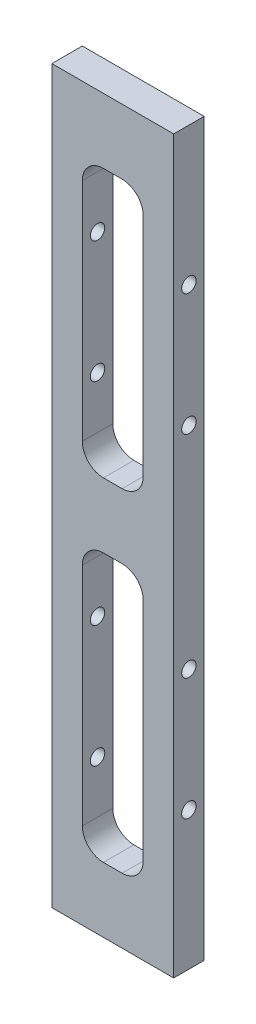
from build123d import *

# Parameters (mm, degrees)
SKETCH1_W             = 19.05
SKETCH1_H             = 114.3
BOSS_EXTRUDE1_DEPTH   = 4.7625
SKETCH2_W             = 9.525
SKETCH2_H             = 41.91
CUT_EXTRUDE1_DEPTH    = 59.13372112
FILLET1_R             = 3.302
F_4_40_TAPPED_HOLE1_D = 2.2606


with BuildPart() as part:
    # Sketch1 → Boss-Extrude1 (new body)
    with BuildSketch(Plane.XY):
        Rectangle(SKETCH1_W, SKETCH1_H)
    extrude(amount=BOSS_EXTRUDE1_DEPTH)

    # Sketch2 → Cut-Extrude1 (cut, through all)
    with BuildSketch(Plane.XY.offset(4.7625)):
        with Locations((0, 26.035)):
            Rectangle(SKETCH2_W, SKETCH2_H)
        with Locations((0, -26.035)):
            Rectangle(SKETCH2_W, SKETCH2_H)
    extrude(amount=-CUT_EXTRUDE1_DEPTH, mode=Mode.SUBTRACT)

    # Fillet1
    fillet1_edges = [part.edges().sort_by_distance(p)[0] for p in [
        (4.7625, 46.99, 2.38125),
        (4.7625, 5.08, 2.38125),
        (-4.7625, 5.08, 2.38125),
        (-4.7625, 46.99, 2.38125),
        (-4.7625, -46.99, 2.38125),
        (-4.7625, -5.08, 2.38125),
        (4.7625, -5.08, 2.38125),
        (4.7625, -46.99, 2.38125),
    ]]
    fillet(fillet1_edges, radius=FILLET1_R)

    # #4-40 Tapped Hole1 (through all)
    with Locations(Plane(origin=(9.525, 0, 0), x_dir=(0, 0, -1), z_dir=(1, 0, 0))):
        with Locations((-2.38125, 35.56), (-2.38125, 16.51), (-2.38125, -16.51), (-2.38125, -35.56)):
            Hole(F_4_40_TAPPED_HOLE1_D / 2)


solid = part.part
